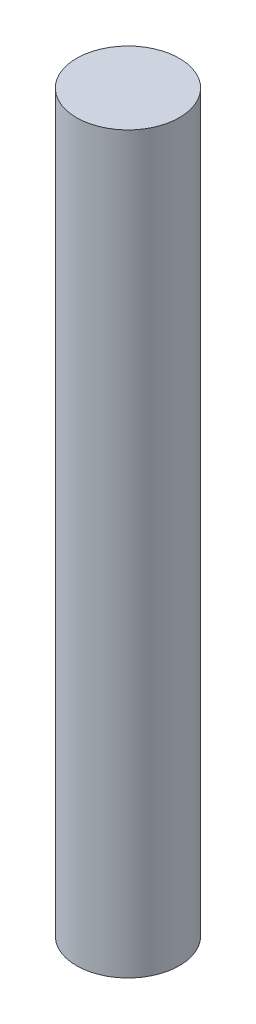
from build123d import *

# Parameters (mm, degrees)
SZKIC2_R                    = 35
DODANIE_WYCI_GNI_CIE1_DEPTH = 500


with BuildPart() as part:
    # Szkic2 → Dodanie-wyciągnięcie1 (new body)
    with BuildSketch(Plane(origin=(0, 0, 0), x_dir=(1, 0, 0), z_dir=(0, 1, 0))):
        with Locations(Location((0, 0, 0), (0, 0, 270))):
            Circle(SZKIC2_R)
    extrude(amount=DODANIE_WYCI_GNI_CIE1_DEPTH)


solid = part.part
